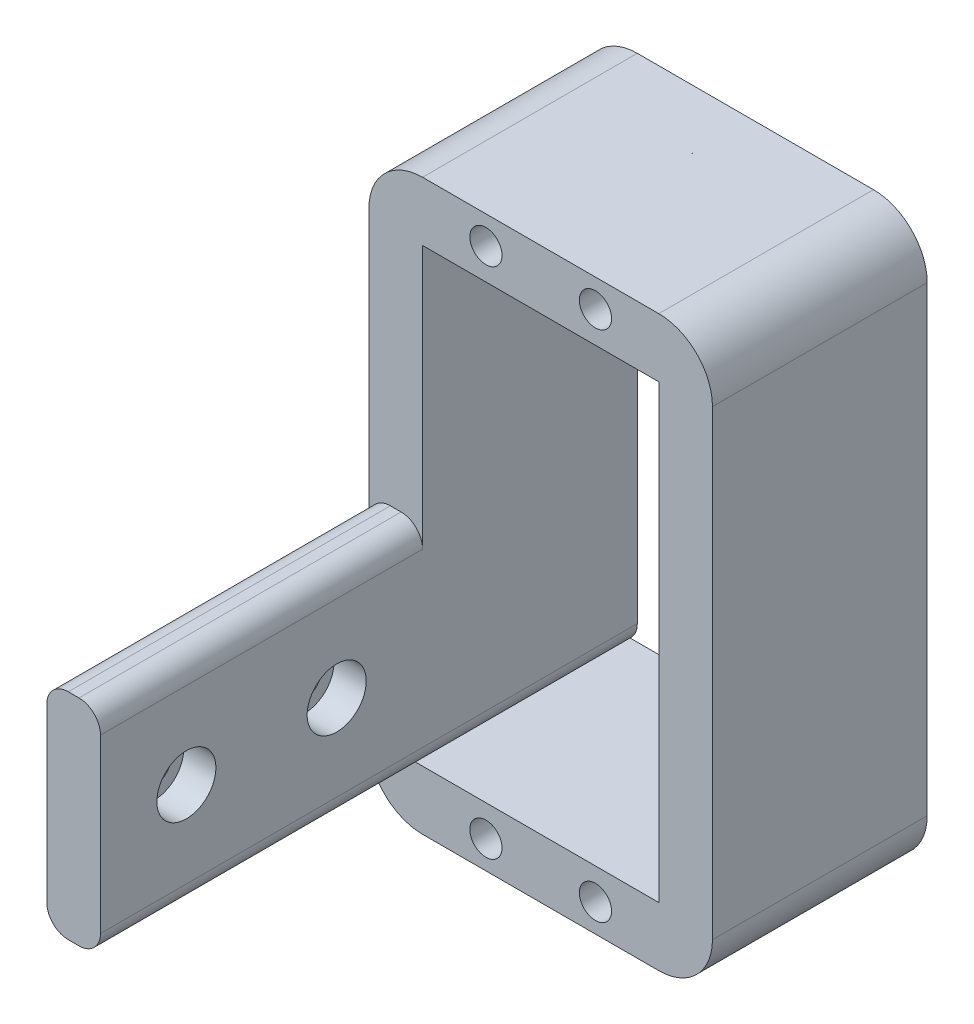
from build123d import *

# Parameters (mm, degrees)
SKETCH1_W           = 32
SKETCH1_H           = 53
SKETCH1_W_2         = 22
SKETCH1_H_2         = 42
BOSS_EXTRUDE1_DEPTH = 20
SKETCH2_W           = 5
SKETCH2_H           = 20
BOSS_EXTRUDE2_DEPTH = 30
SKETCH3_R           = 2.75
SKETCH3_R_2         = 1.6
CUT_EXTRUDE1_DEPTH  = 3
SKETCH3_2_R         = 1.6
CUT_EXTRUDE2_DEPTH  = 63.69968102
SKETCH4_R           = 1.5
CUT_EXTRUDE3_DEPTH  = 59.806887352
FILLET1_R           = 5
FILLET2_R           = 2


with BuildPart() as part:
    # Sketch1 → Boss-Extrude1 (new body)
    with BuildSketch(Plane.XY):
        Rectangle(SKETCH1_W, SKETCH1_H)
        Rectangle(SKETCH1_W_2, SKETCH1_H_2, mode=Mode.SUBTRACT)
    extrude(amount=BOSS_EXTRUDE1_DEPTH)

    # Sketch2 → Boss-Extrude2 (add)
    with BuildSketch(Plane.XY.offset(20)):
        with Locations((-13.5, -11.5)):
            Rectangle(SKETCH2_W, SKETCH2_H)
    extrude(amount=BOSS_EXTRUDE2_DEPTH)

    # Sketch3 → Cut-Extrude1 (cut)
    # profile 1 of 2: a face of its own
    with BuildSketch(Plane(origin=(-11, 0, 0), x_dir=(0, 0, -1), z_dir=(1, 0, 0))):
        with Locations((-42, -11.5)):
            Circle(SKETCH3_R)
        with Locations((-42, -11.5)):
            Circle(SKETCH3_R_2, mode=Mode.SUBTRACT)
    # profile 2 of 2: a face of its own
    with BuildSketch(Plane(origin=(-11, 0, 0), x_dir=(0, 0, -1), z_dir=(1, 0, 0))):
        with Locations((-28, -11.5)):
            Circle(SKETCH3_R)
        with Locations((-28, -11.5)):
            Circle(SKETCH3_R_2, mode=Mode.SUBTRACT)
    extrude(amount=-CUT_EXTRUDE1_DEPTH, mode=Mode.SUBTRACT)

    # Sketch3<2> → Cut-Extrude2 (cut, through all)
    with BuildSketch(Plane(origin=(-11, 0, 0), x_dir=(0, 0, -1), z_dir=(1, 0, 0))):
        with Locations((-42, -11.5)):
            Circle(SKETCH3_2_R)
        with Locations((-28, -11.5)):
            Circle(SKETCH3_2_R)
    extrude(amount=-CUT_EXTRUDE2_DEPTH, mode=Mode.SUBTRACT)

    # Sketch4 → Cut-Extrude3 (cut, through all)
    with BuildSketch(Plane(origin=(0, 0, 0), x_dir=(-1, 0, 0), z_dir=(0, 0, -1))):
        with Locations((-5.1, -23.9)):
            Circle(SKETCH4_R)
        with Locations((5.1, -23.9)):
            Circle(SKETCH4_R)
        with Locations((-5.1, 23.9)):
            Circle(SKETCH4_R)
        with Locations((5.1, 23.9)):
            Circle(SKETCH4_R)
    extrude(amount=-CUT_EXTRUDE3_DEPTH, mode=Mode.SUBTRACT)

    # Fillet1
    fillet1_edges = [part.edges().sort_by_distance(p)[0] for p in [
        (-16, -26.5, 10),
        (16, -26.5, 10),
        (-16, 26.5, 10),
        (16, 26.5, 10),
    ]]
    fillet(fillet1_edges, radius=FILLET1_R)

    # Fillet2
    fillet2_edges = [part.edges().sort_by_distance(p)[0] for p in [
        (-16, -1.5, 35),
        (-16, -21.5, 35),
        (-11, -1.5, 35),
        (-11, -21.5, 35),
    ]]
    fillet(fillet2_edges, radius=FILLET2_R)


solid = part.part
